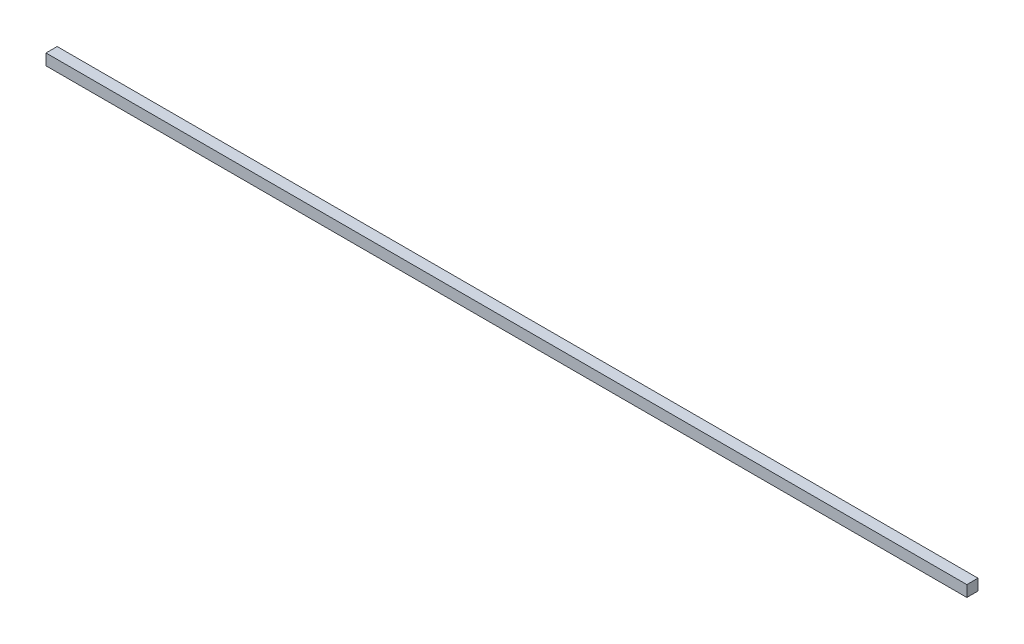
from build123d import *

# Parameters (mm, degrees)
TOPPING_KLAPE_KAT2_PIVOT_MIL_1_START = 22
SKETCH1_W                            = 660
SKETCH1_H                            = 8
TOPPING_KLAPE_KAT2_PIVOT_MIL_1_DEPTH = 8


with BuildPart() as part:
    # Sketch1 → TOPPING_klape_kat2_pivot_mil_1 (new body)
    with BuildSketch(Plane.XY.offset(TOPPING_KLAPE_KAT2_PIVOT_MIL_1_START)):
        with Locations((350, 1156)):
            Rectangle(SKETCH1_W, SKETCH1_H)
    extrude(amount=TOPPING_KLAPE_KAT2_PIVOT_MIL_1_DEPTH)


solid = part.part
